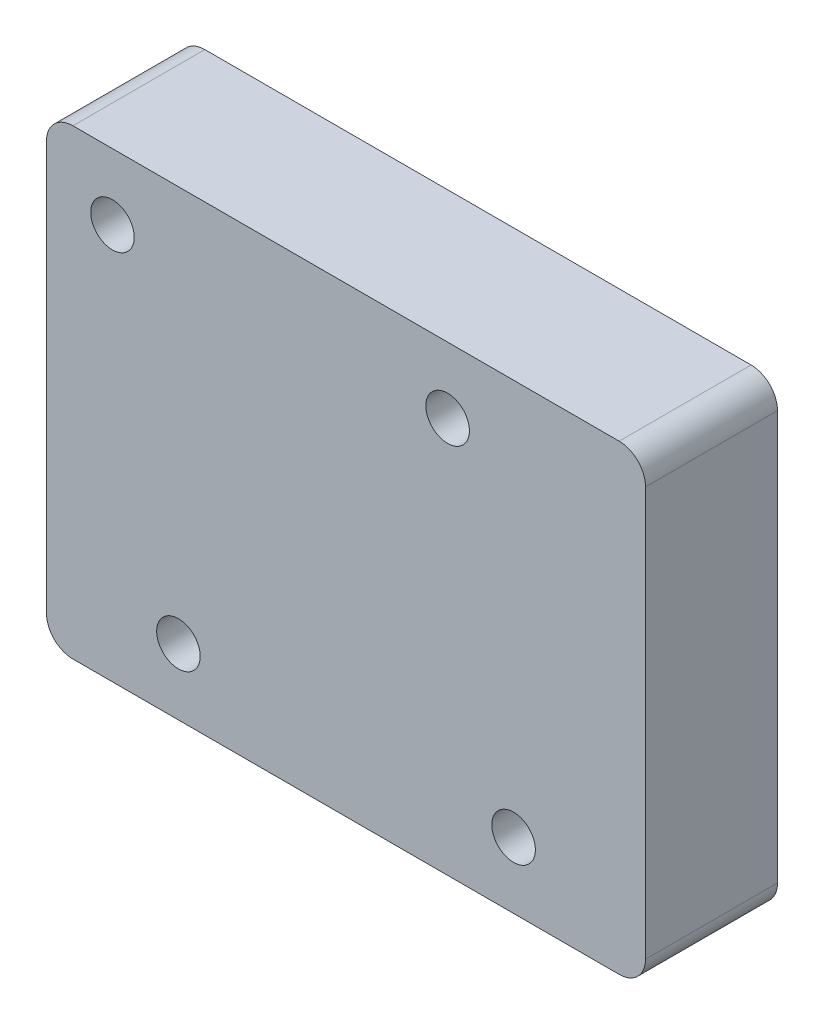
from build123d import *

# Parameters (mm, degrees)
SKETCH_1_W          = 45.4
SKETCH_1_H          = 35
SKETCH_1_R          = 1.65
EXTRUDE_1_DEPTH     = 10
FILLET_1_R          = 2
SKETCH_2_R          = 1.65
CUT_EXTRUDE_1_DEPTH = 10


with BuildPart() as part:
    # ｽｹｯﾁ1 → ﾎﾞｽ - 押し出し1 (new body)
    with BuildSketch(Plane.XY):
        with Locations((22.7, 17.5)):
            Rectangle(SKETCH_1_W, SKETCH_1_H)
        with Locations((10, 5)):
            Circle(SKETCH_1_R, mode=Mode.SUBTRACT)
        with Locations((35.4, 5)):
            Circle(SKETCH_1_R, mode=Mode.SUBTRACT)
        with Locations((5, 30)):
            Circle(SKETCH_1_R, mode=Mode.SUBTRACT)
        with Locations((30.4, 30)):
            Circle(SKETCH_1_R, mode=Mode.SUBTRACT)
    extrude(amount=EXTRUDE_1_DEPTH)

    # ﾌｨﾚｯﾄ1
    fillet_1_edges = [part.edges().sort_by_distance(p)[0] for p in [
        (0, 35, 5),
        (45.4, 35, 5),
        (45.4, 0, 5),
        (0, 0, 5),
    ]]
    fillet(fillet_1_edges, radius=FILLET_1_R)

    # ｽｹｯﾁ2 → ｶｯﾄ - 押し出し1 (cut)
    with BuildSketch(Plane.XZ):
        with Locations(Location((2.7, 5, 0), (0, 0, 270))):
            Circle(SKETCH_2_R)
        with Locations(Location((42.7, 5, 0), (0, 0, 270))):
            Circle(SKETCH_2_R)
    extrude(amount=-CUT_EXTRUDE_1_DEPTH, mode=Mode.SUBTRACT)


solid = part.part
